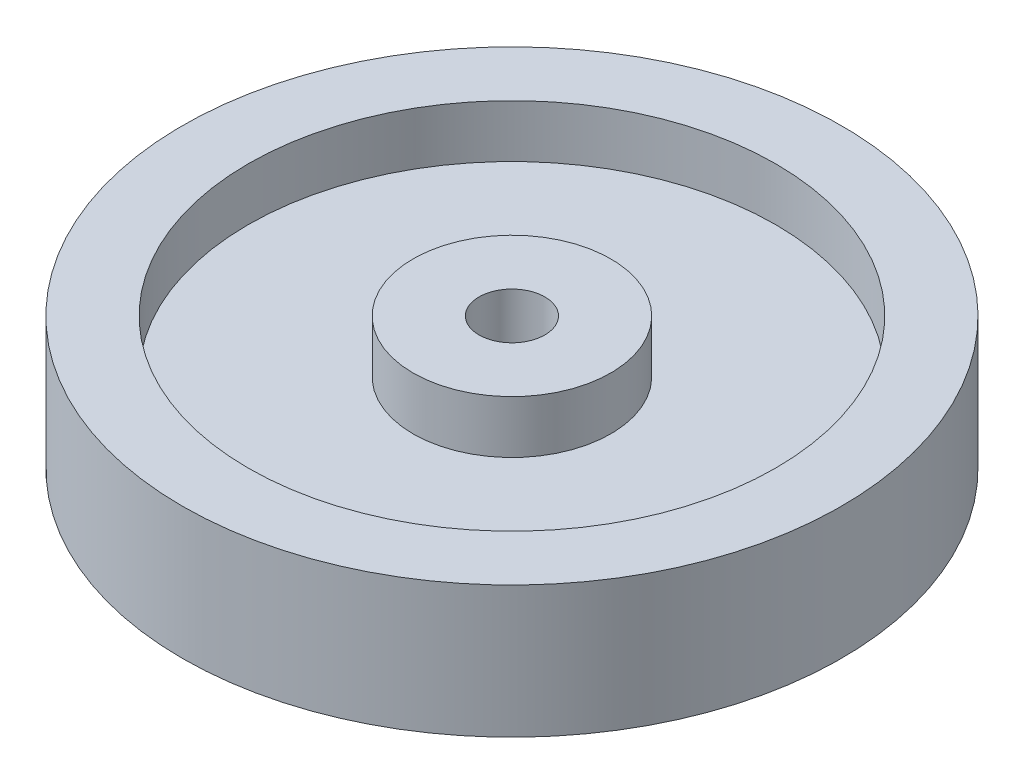
from build123d import *

# Parameters (mm, degrees)
BOSS_EXTRUDE1_DEPTH        = 5
BOSS_EXTRUDE1_DEPTH_BACK   = 5
SKETCH1_R                  = 7.5
SKETCH1_R_2                = 2.5
BOSS_EXTRUDE1_2_DEPTH      = 5
BOSS_EXTRUDE1_2_DEPTH_BACK = 5
SKETCH1_R_3                = 25
SKETCH1_R_4                = 20
BOSS_EXTRUDE2_DEPTH        = 1
BOSS_EXTRUDE2_DEPTH_BACK   = 1
SKETCH1_3_R                = 20
SKETCH1_3_R_2              = 7.5


with BuildPart() as part:
    # Sketch1 → Boss-Extrude1 (new, two sides: drawn at the far end of the back side and taken through both)
    with BuildSketch(Plane(origin=(0, 0, 0), x_dir=(1, 0, 0), z_dir=(0, 1, 0)).offset(-BOSS_EXTRUDE1_DEPTH_BACK)):
        Circle(SKETCH1_R)
        Circle(SKETCH1_R_2, mode=Mode.SUBTRACT)
    extrude(amount=BOSS_EXTRUDE1_DEPTH + BOSS_EXTRUDE1_DEPTH_BACK)



with BuildPart() as body_2:
    # Sketch1 → Boss-Extrude1 2 (new, two sides: drawn at the far end of the back side and taken through both)
    with BuildSketch(Plane(origin=(0, 0, 0), x_dir=(1, 0, 0), z_dir=(0, 1, 0)).offset(-BOSS_EXTRUDE1_2_DEPTH_BACK)):
        Circle(SKETCH1_R_3)
        Circle(SKETCH1_R_4, mode=Mode.SUBTRACT)
    extrude(amount=BOSS_EXTRUDE1_2_DEPTH + BOSS_EXTRUDE1_2_DEPTH_BACK)


with BuildPart() as part_1:
    add(part.part)

    add(body_2.part)  # Boss-Extrude2 merges body 2
    # Sketch1<3> → Boss-Extrude2 (add, two sides: drawn at the far end of the back side and taken through both)
    with BuildSketch(Plane(origin=(0, 0, 0), x_dir=(1, 0, 0), z_dir=(0, 1, 0)).offset(-BOSS_EXTRUDE2_DEPTH_BACK)):
        Circle(SKETCH1_3_R)
        Circle(SKETCH1_3_R_2, mode=Mode.SUBTRACT)
    extrude(amount=BOSS_EXTRUDE2_DEPTH + BOSS_EXTRUDE2_DEPTH_BACK)


solid = part_1.part
